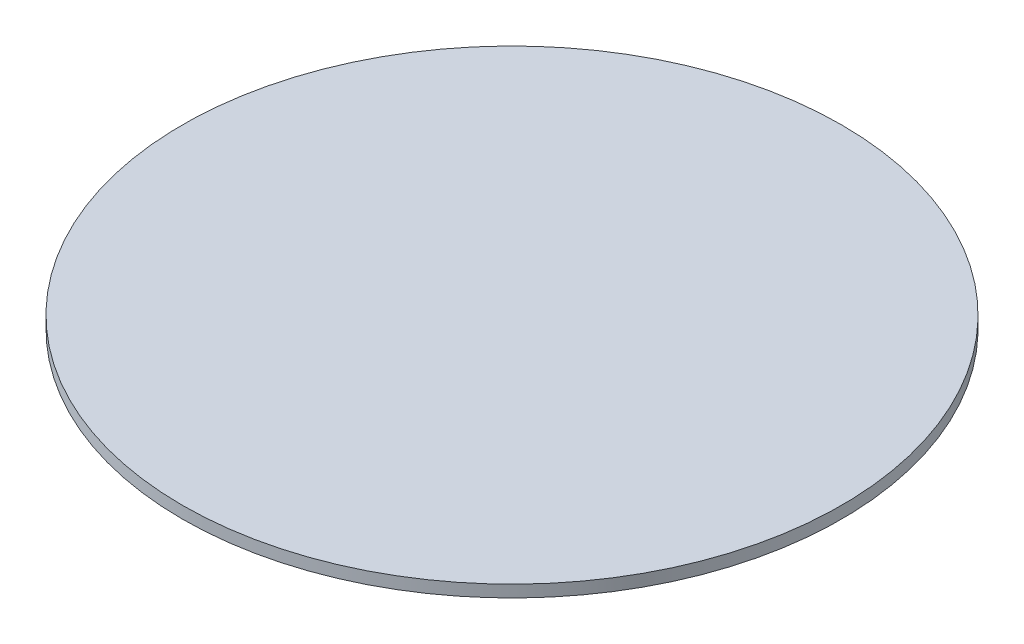
from build123d import *

# Parameters (mm, degrees)
OVEN_KESME_TEPSI_HALKASI_D330_START = 340
SKETCH1_R                           = 165
OVEN_KESME_TEPSI_HALKASI_D330_DEPTH = 6


with BuildPart() as part:
    # Sketch1 → OVEN_kesme_tepsi_halkasi_D330 (new body)
    with BuildSketch(Plane(origin=(0, 0, 0), x_dir=(1, 0, 0), z_dir=(0, 1, 0)).offset(OVEN_KESME_TEPSI_HALKASI_D330_START)):
        with Locations(Location((350, 300, 0), (0, 0, 270))):
            Circle(SKETCH1_R)
    extrude(amount=OVEN_KESME_TEPSI_HALKASI_D330_DEPTH)


solid = part.part
